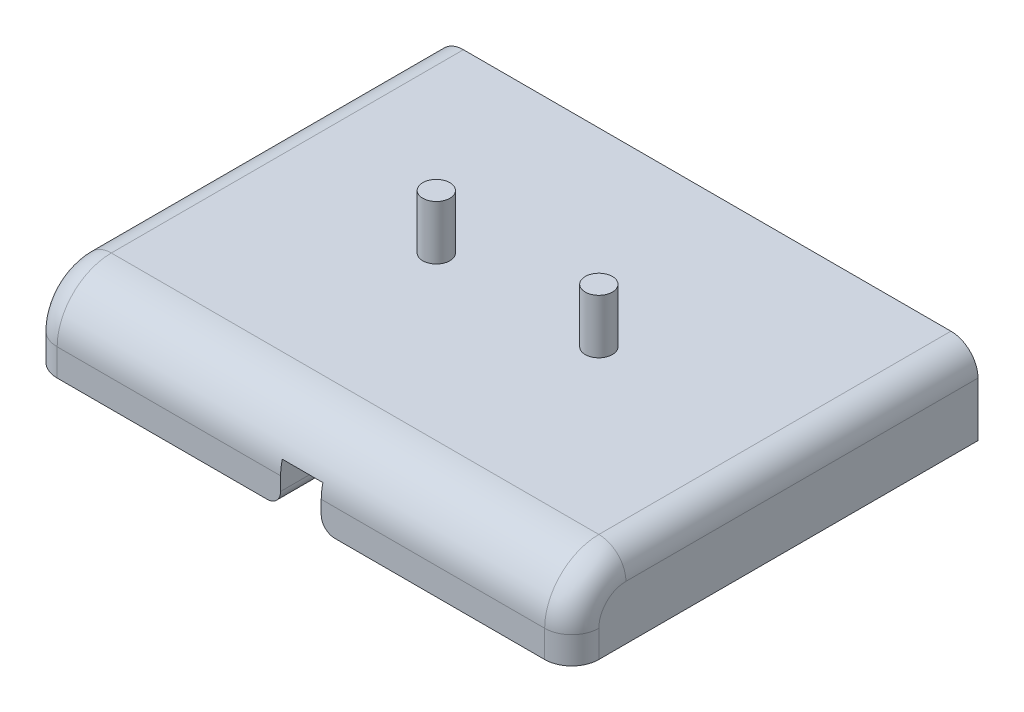
from build123d import *

# Parameters (mm, degrees)
SKETCH1_W           = 200
SKETCH1_H           = 150
BOSS_EXTRUDE1_DEPTH = 30
FILLET1_R           = 20
FILLET2_R           = 10
SKETCH2_W           = 15
SKETCH2_H           = 15
CUT_EXTRUDE1_DEPTH  = 183.756668825
FILLET4_R           = 5
SKETCH3_R           = 5
BOSS_EXTRUDE2_DEPTH = 20


with BuildPart() as part:
    # Sketch1 → Boss-Extrude1 (new body)
    with BuildSketch(Plane(origin=(0, 0, 0), x_dir=(1, 0, 0), z_dir=(0, 1, 0))):
        Rectangle(SKETCH1_W, SKETCH1_H)
    extrude(amount=BOSS_EXTRUDE1_DEPTH)

    # Fillet1
    fillet1_edges = [part.edges().sort_by_distance(p)[0] for p in [
        (0, 30, 75),
    ]]
    fillet(fillet1_edges, radius=FILLET1_R)

    # Fillet2
    fillet2_edges = [part.edges().sort_by_distance(p)[0] for p in [
        (100, 30, -10),
        (100, 5, 75),
        (100, 24.142135624, 69.142135624),
        (-100, 5, 75),
        (-100, 24.142135624, 69.142135624),
        (-100, 30, -10),
    ]]
    fillet(fillet2_edges, radius=FILLET2_R)

    # Sketch2 → Cut-Extrude1 (cut, through all)
    with BuildSketch(Plane.XY.offset(75)):
        with Locations((0, 7.5)):
            Rectangle(SKETCH2_W, SKETCH2_H)
    extrude(amount=-CUT_EXTRUDE1_DEPTH, mode=Mode.SUBTRACT)

    # Fillet4
    fillet4_edges = [part.edges().sort_by_distance(p)[0] for p in [
        (-7.5, 0, 0),
        (7.5, 0, 0),
    ]]
    fillet(fillet4_edges, radius=FILLET4_R)

    # Sketch3 → Boss-Extrude2 (add)
    with BuildSketch(Plane(origin=(0, 30, 0), x_dir=(1, 0, 0), z_dir=(0, 1, 0))):
        with Locations(Location((30, 5, 0), (0, 0, 270))):
            Circle(SKETCH3_R)
    boss_extrude2 = extrude(amount=BOSS_EXTRUDE2_DEPTH)

    # Mirror1: Boss-Extrude2 across plane
    add(boss_extrude2.mirror(Plane(origin=(0, 0, 0), x_dir=(0, 0, 1), z_dir=(1, 0, 0))))


solid = part.part
